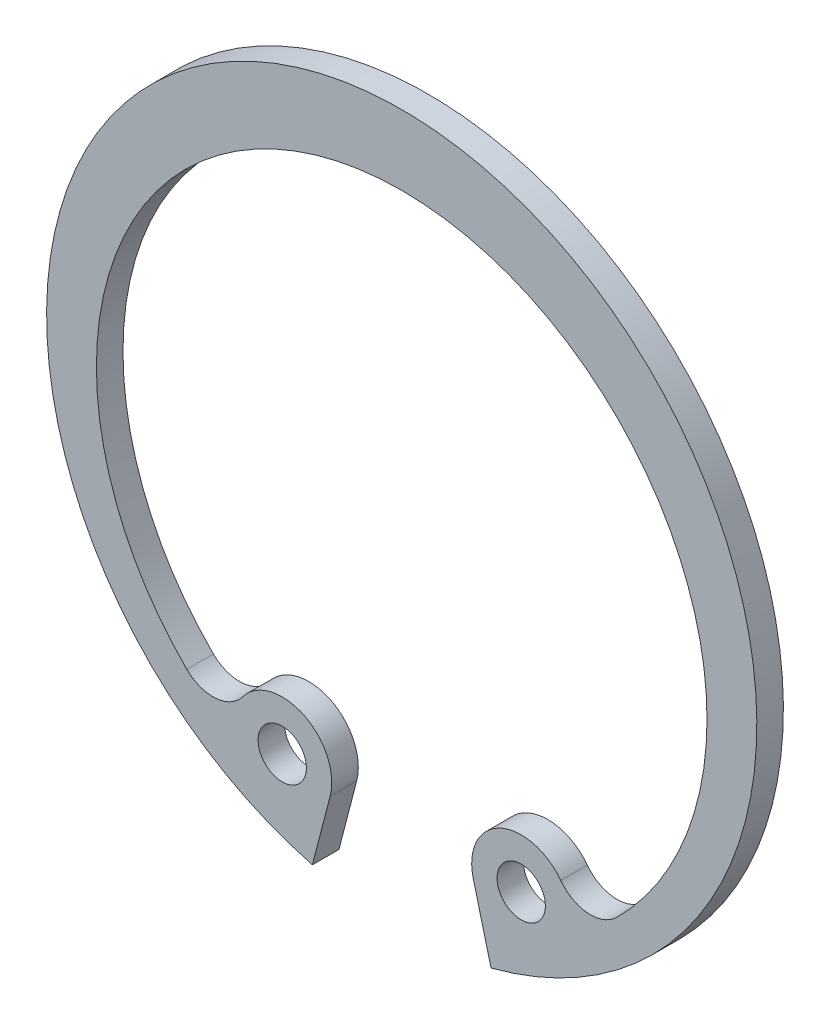
from build123d import *

# Parameters (mm, degrees)
BODYSKE_R  = 1
BODY_DEPTH = 1.1


with BuildPart() as part:
    # BodySke → Body (new body)
    with BuildSketch(Plane.XY):
        with BuildLine():
            Line((3.698325427, -14.227170802), (2.961893262, -11.394173437))
            ThreePointArc((2.961893262, -11.394173437), (4.055312562, -9.032003244), (6.584655155, -9.646690019))
            ThreePointArc((6.584655155, -9.646690019), (7.702025194, -10.256332456), (8.895921915, -9.814981887))
            ThreePointArc((8.895921915, -9.814981887), (0, 11.8), (-8.895921915, -9.814981887))
            ThreePointArc((-8.895921915, -9.814981887), (-7.702025194, -10.256332456), (-6.584655155, -9.646690019))
            ThreePointArc((-6.584655155, -9.646690019), (-4.055312562, -9.032003244), (-2.961893262, -11.394173437))
            Line((-2.961893262, -11.394173437), (-3.698325427, -14.227170802))
            ThreePointArc((-3.698325427, -14.227170802), (0, 14.7), (3.698325427, -14.227170802))
        make_face()
        with Locations((4.945954497, -10.878420571)):
            Circle(BODYSKE_R, mode=Mode.SUBTRACT)
        with Locations((-4.945954497, -10.878420571)):
            Circle(BODYSKE_R, mode=Mode.SUBTRACT)
    extrude(amount=-BODY_DEPTH)


solid = part.part
